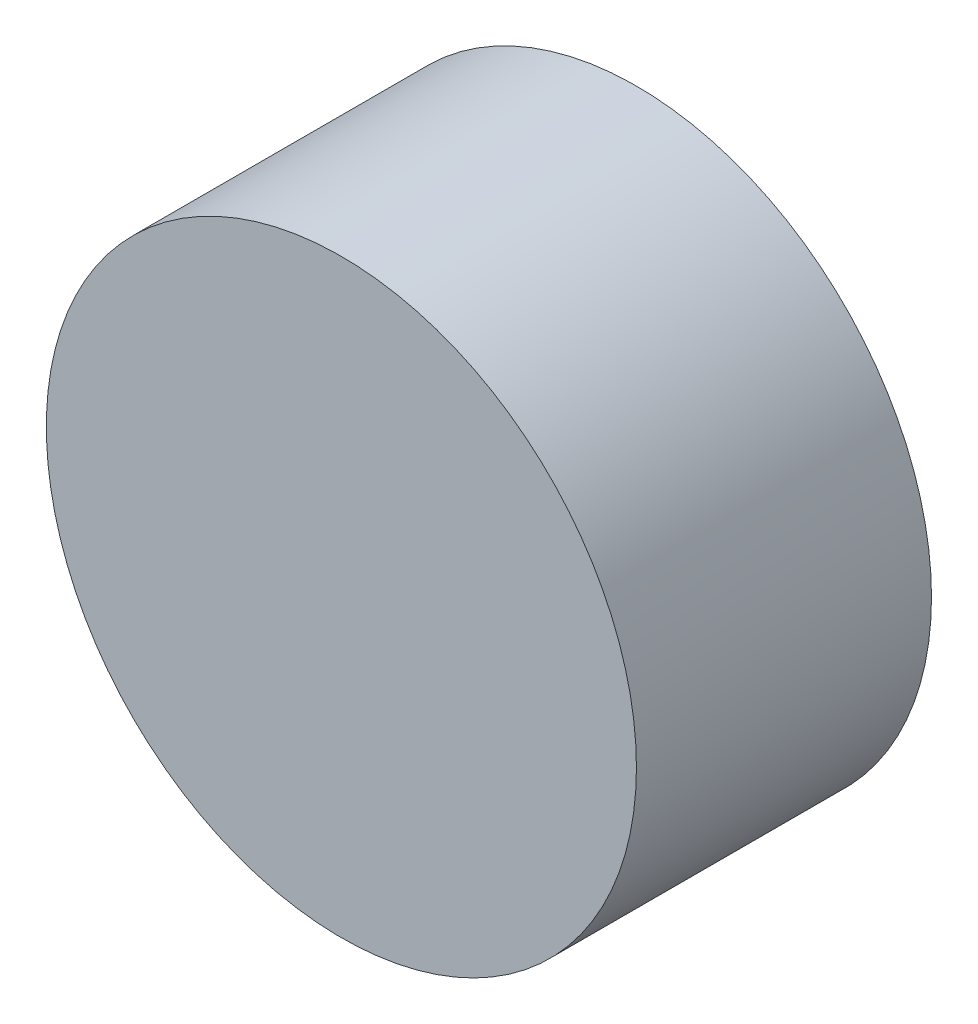
from build123d import *

# Parameters (mm, degrees)
SKICA1_R                = 5
P_IDAT_VYSUNUT_M1_DEPTH = 5


with BuildPart() as part:
    # Skica1 → Přidat vysunutím1 (new body)
    with BuildSketch(Plane.XY):
        Circle(SKICA1_R)
    extrude(amount=P_IDAT_VYSUNUT_M1_DEPTH)


solid = part.part
